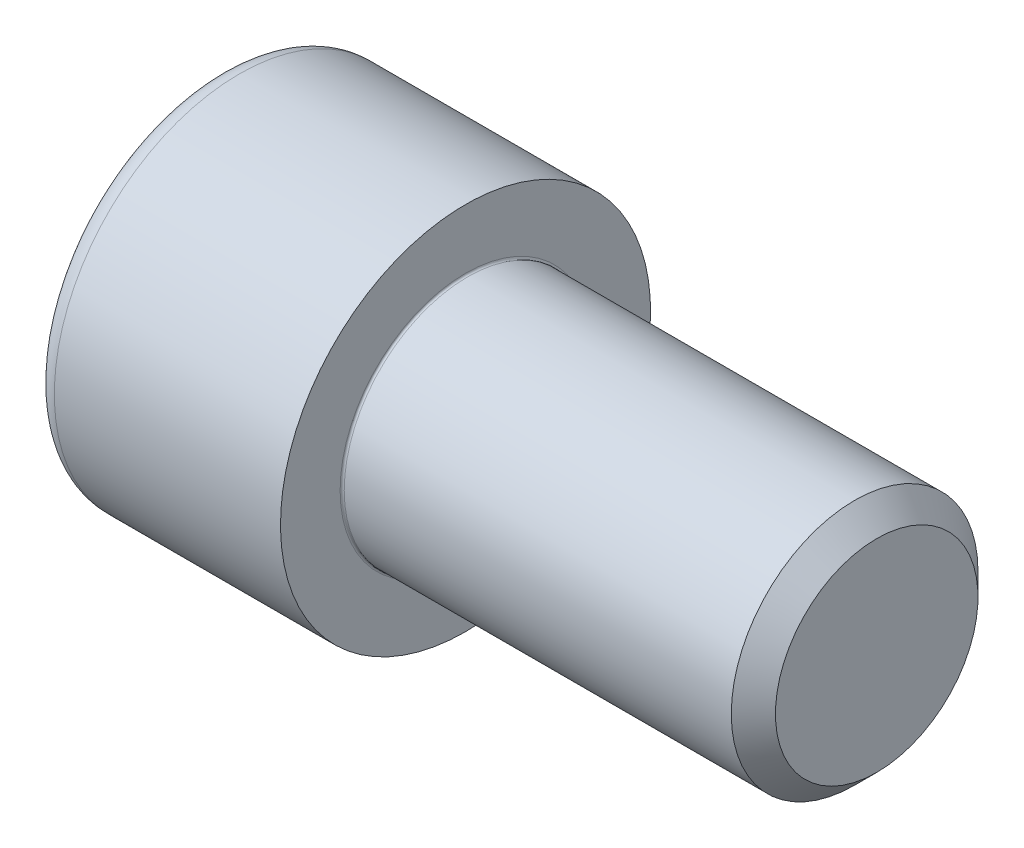
from build123d import *

# Parameters (mm, degrees)
EXTRUDE_562_REACH = 36.438
SKETCH_2_R        = 5.773502692
FILLET_616_R      = 1
CHAMFER_1_SIZE    = 1.0735375
FILLET_2_R        = 0.1


with BuildPart() as part:
    # 草圖1 → Revolve 435 (revolve)
    with BuildSketch(Plane.XY, mode=Mode.PRIVATE) as revolve_435_sk:
        Polygon((-2.066666667, 0), (20, 0), (20, 6), (4.3, 6), (3.2263625, 6), (0, 6), (0, 9), (-12, 9), (-12, 5.773502692), (-5.4, 5.773502692), align=None)
    revolve(revolve_435_sk.sketch.rotate(Axis((-2.066666667, 0, 0), (1, 0, 0)), 180), axis=Axis((-2.066666667, 0, 0), (1, 0, 0)))

    # 草圖2 → Extrude 562 (add, up to next)
    with BuildSketch(Plane.ZY.offset(12), mode=Mode.PRIVATE) as extrude_562_sk1:
        Circle(SKETCH_2_R)
    extrude_562_tool1 = extrude(extrude_562_sk1.sketch, amount=-EXTRUDE_562_REACH, mode=Mode.PRIVATE) - part.part
    # 草圖2 → Extrude 562 (add, up to next)
    with BuildSketch(Plane.ZY.offset(12), mode=Mode.PRIVATE) as extrude_562_sk2:
        Polygon((5.773502692, 0), (2.886751346, -5), (-2.886751346, -5), (-5.773502692, 0), (-2.886751346, 5), (2.886751346, 5), align=None)
    extrude_562_tool2 = extrude(extrude_562_sk2.sketch, amount=-EXTRUDE_562_REACH, mode=Mode.PRIVATE) - part.part
    add(extrude_562_tool1.solids().sort_by_distance((-12, 0, 0))[0])
    add(extrude_562_tool2.solids().sort_by_distance((-12, 0, 0))[0])

    # Fillet 616
    fillet_616_edges = [part.edges().sort_by_distance(p)[0] for p in [
        (-12, 9, 0),
    ]]
    fillet(fillet_616_edges, radius=FILLET_616_R)

    # 倒角1
    chamfer_1_edges = [part.edges().sort_by_distance(p)[0] for p in [
        (20, 6, 0),
    ]]
    chamfer(chamfer_1_edges, length=CHAMFER_1_SIZE)

    # 圓角2
    fillet_2_edges = [part.edges().sort_by_distance(p)[0] for p in [
        (0, 6, 0),
    ]]
    fillet(fillet_2_edges, radius=FILLET_2_R)


solid = part.part
